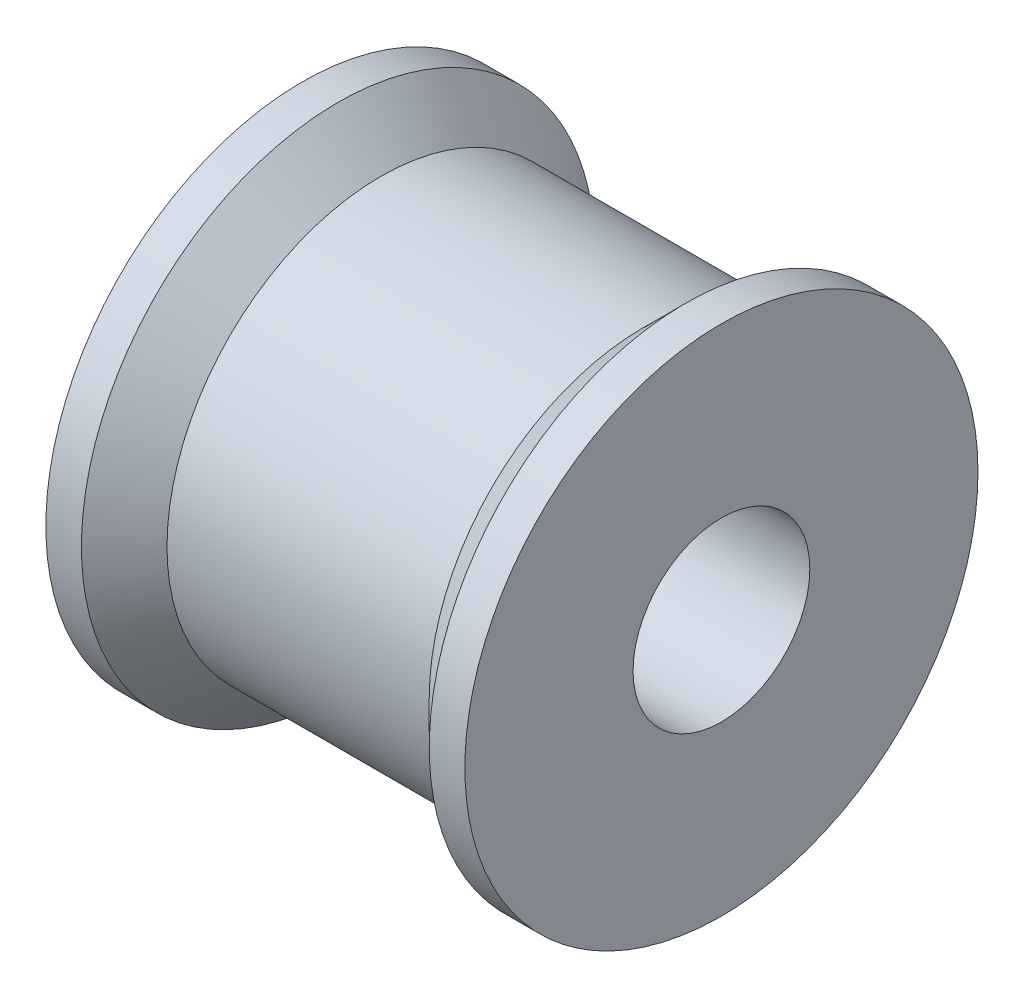
from build123d import *

# Parameters (mm, degrees)
SKETCH3_R          = 3.1
CUT_EXTRUDE1_DEPTH = 14.7


with BuildPart() as part:
    # Sketch2 → Revolve1 (revolve)
    with BuildSketch(Plane(origin=(0, 0, 0), x_dir=(1, 0, 0), z_dir=(0, 1, 0))):
        Polygon((-7.35, 9), (-6.1, 9), (-4.6, 7.5), (4.6, 7.5), (6.1, 9), (7.35, 9), (7.35, 0), (-7.35, 0), align=None)
    revolve(axis=Axis((7.35, 0, 0), (-1, 0, 0)))

    # Sketch3 → Cut-Extrude1 (cut)
    with BuildSketch(Plane.ZY.offset(7.35)):
        Circle(SKETCH3_R)
    extrude(amount=-CUT_EXTRUDE1_DEPTH, mode=Mode.SUBTRACT)


solid = part.part
